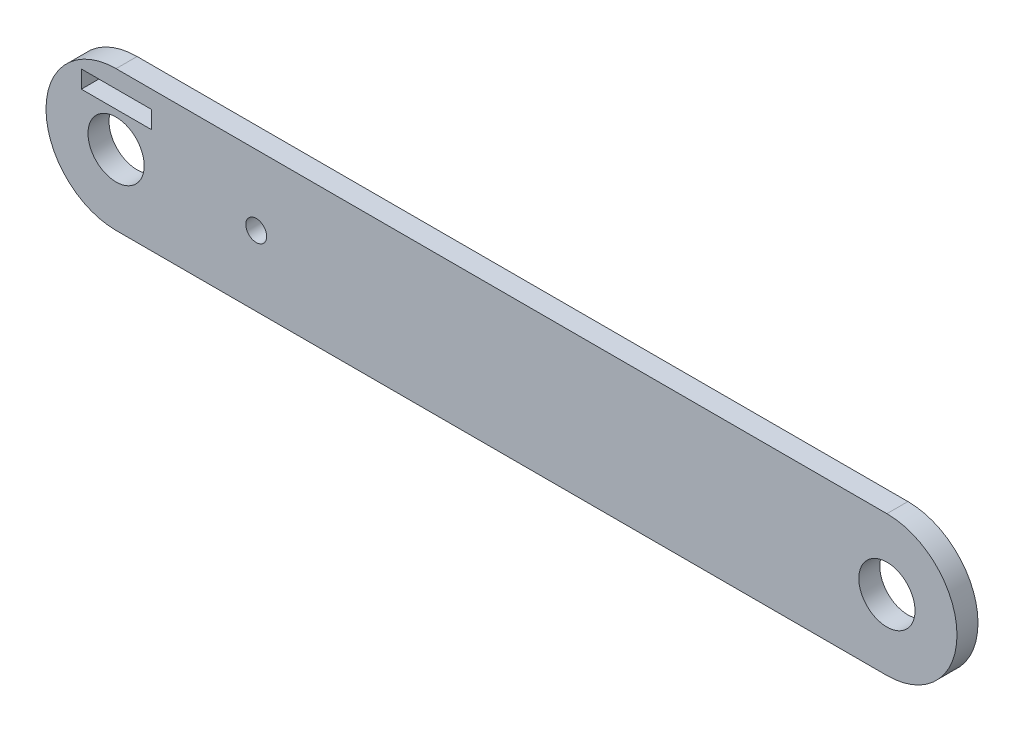
from build123d import *

# Parameters (mm, degrees)
SKETCH1_R           = 4.01
BOSS_EXTRUDE1_DEPTH = 3
CUT_EXTRUDE2_REACH  = 122.453
SKETCH4_W           = 10
SKETCH4_H           = 2.5
SKETCH2_R           = 1.49
CUT_EXTRUDE3_DEPTH  = 10


with BuildPart() as part:
    # Sketch1 → Boss-Extrude1 (new body)
    with BuildSketch(Plane.XY):
        with BuildLine():
            Line((110, 10), (0, 10))
            ThreePointArc((0, 10), (-10, 0), (0, -10))
            Line((0, -10), (110, -10))
            ThreePointArc((110, -10), (120, 0), (110, 10))
        make_face()
        Circle(SKETCH1_R, mode=Mode.SUBTRACT)
        with Locations((110, 0)):
            Circle(SKETCH1_R, mode=Mode.SUBTRACT)
    extrude(amount=BOSS_EXTRUDE1_DEPTH)

    # Sketch4 → Cut-Extrude2 (cut, up to next)
    with BuildSketch(Plane(origin=(0, 0, 0), x_dir=(-1, 0, 0), z_dir=(0, 0, -1)), mode=Mode.PRIVATE) as cut_extrude2_sk1:
        with Locations((-0.046889456, 6.235161972)):
            Rectangle(SKETCH4_W, SKETCH4_H)
    cut_extrude2_tool1 = extrude(cut_extrude2_sk1.sketch, amount=-CUT_EXTRUDE2_REACH, mode=Mode.PRIVATE) & part.part
    add(cut_extrude2_tool1.solids().sort_by_distance((0.046889, 6.235162, 0))[0], mode=Mode.SUBTRACT)

    # Sketch2 → Cut-Extrude3 (cut)
    with BuildSketch(Plane(origin=(0, 0, 0), x_dir=(-1, 0, 0), z_dir=(0, 0, -1))):
        with Locations((-20, 0)):
            Circle(SKETCH2_R)
    extrude(amount=-CUT_EXTRUDE3_DEPTH, mode=Mode.SUBTRACT)


solid = part.part
